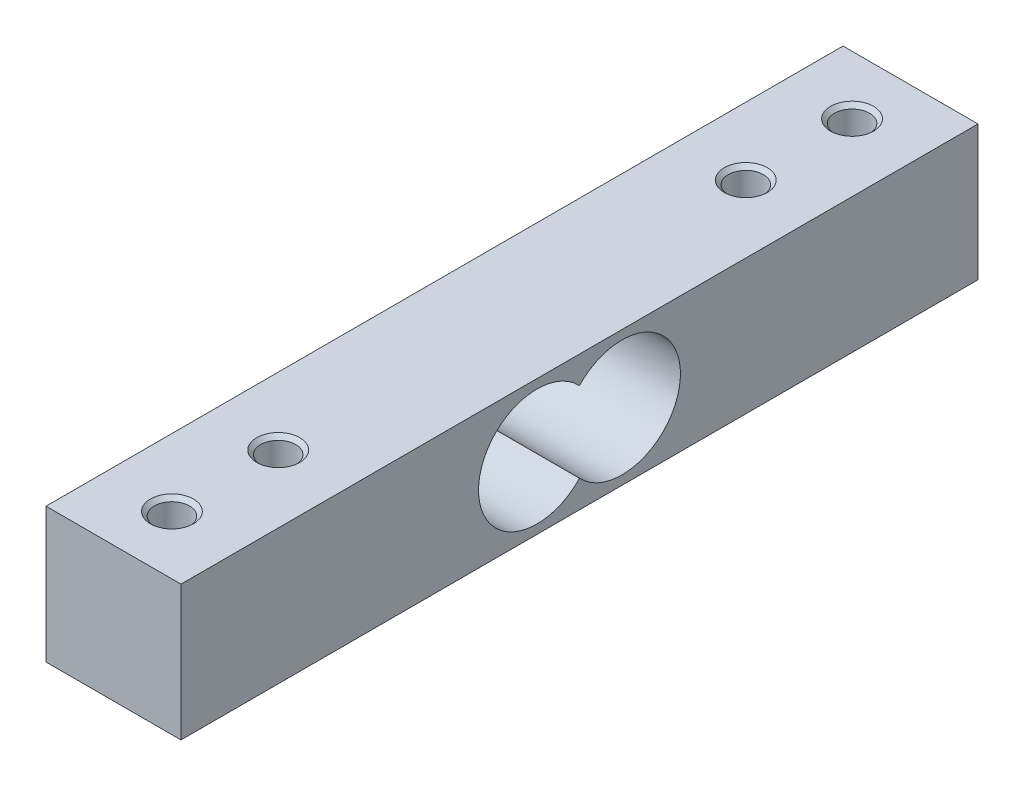
from build123d import *

# Parameters (mm, degrees)
ESBO_O2_W                       = 12.7
ESBO_O2_H                       = 12.7
RESSALTO_EXTRUS_O2_DEPTH        = 75
CORTE_EXTRUS_O1_DEPTH           = 77.33225072
FURO_ROSCADO_DE_M41_D           = 3.3
FURO_ROSCADO_DE_M41_CSINK_D     = 4.05
FURO_ROSCADO_DE_M41_CSINK_ANGLE = 90


with BuildPart() as part:
    # Esboço2 → Ressalto-extrusão2 (new body)
    with BuildSketch(Plane.XY):
        Rectangle(ESBO_O2_W, ESBO_O2_H)
    extrude(amount=-RESSALTO_EXTRUS_O2_DEPTH)

    # Esboço3 → Corte-extrusão1 (cut, through all)
    with BuildSketch(Plane(origin=(6.35, 0, 0), x_dir=(0, 0, -1), z_dir=(1, 0, 0))):
        with BuildLine():
            ThreePointArc((37.5, -3.774917218), (47, 0), (37.5, 3.774917218))
            ThreePointArc((37.5, 3.774917218), (28, 0), (37.5, -3.774917218))
        make_face()
    extrude(amount=-CORTE_EXTRUS_O1_DEPTH, mode=Mode.SUBTRACT)

    # Furo roscado de M41 (through all)
    with Locations(Plane(origin=(0, 6.35, 0), x_dir=(1, 0, 0), z_dir=(0, 1, 0))):
        with Locations((0, 5.5), (0, 15.5), (0, 59.5), (0, 69.5)):
            CounterSinkHole(FURO_ROSCADO_DE_M41_D / 2, FURO_ROSCADO_DE_M41_CSINK_D / 2, counter_sink_angle=FURO_ROSCADO_DE_M41_CSINK_ANGLE)


solid = part.part
